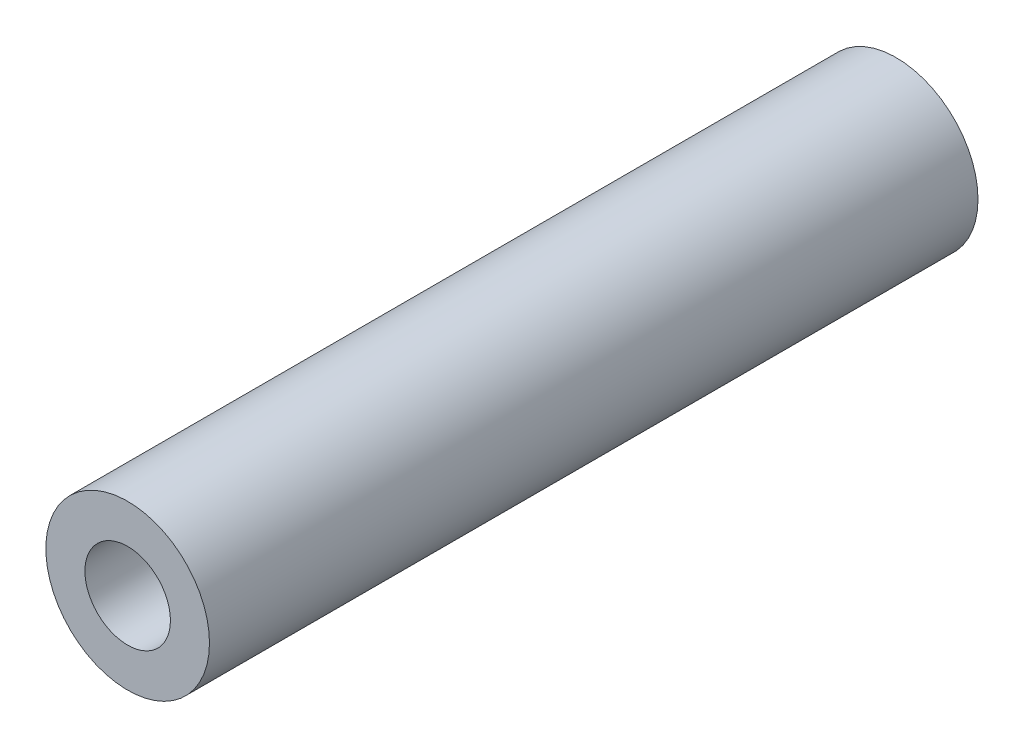
from build123d import *

# Parameters (mm, degrees)
SKETCH1_R           = 4.7625
SKETCH1_R_2         = 2.4892
BOSS_EXTRUDE1_DEPTH = 22.36724


with BuildPart() as part:
    # Sketch1 → Boss-Extrude1 (new, symmetric)
    with BuildSketch(Plane.XY):
        Circle(SKETCH1_R)
        Circle(SKETCH1_R_2, mode=Mode.SUBTRACT)
    extrude(amount=BOSS_EXTRUDE1_DEPTH, both=True)


solid = part.part
